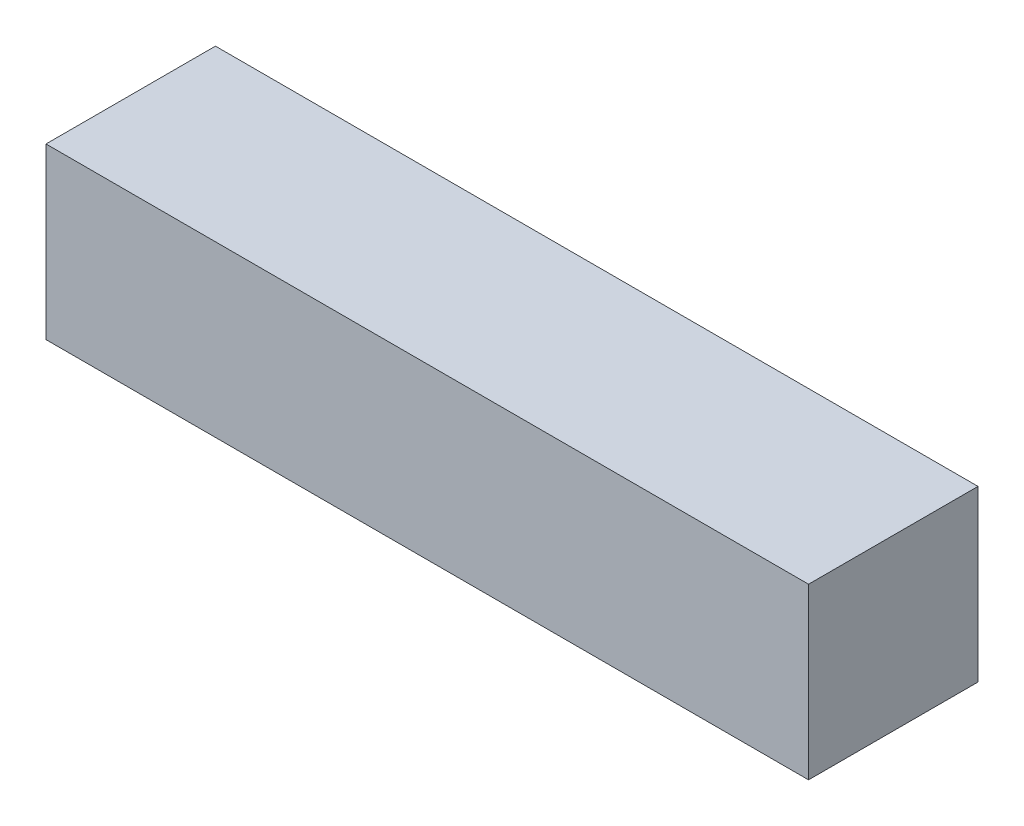
from build123d import *

# Parameters (mm, degrees)
CROQUIS1_W              = 40
CROQUIS1_H              = 40
SALIENTE_EXTRUIR1_DEPTH = 180


with BuildPart() as part:
    # Croquis1 → Saliente-Extruir1 (new body)
    with BuildSketch(Plane(origin=(0, 0, 0), x_dir=(0, 0, -1), z_dir=(1, 0, 0))):
        with Locations((20, 20)):
            Rectangle(CROQUIS1_W, CROQUIS1_H)
    extrude(amount=SALIENTE_EXTRUIR1_DEPTH)


solid = part.part
